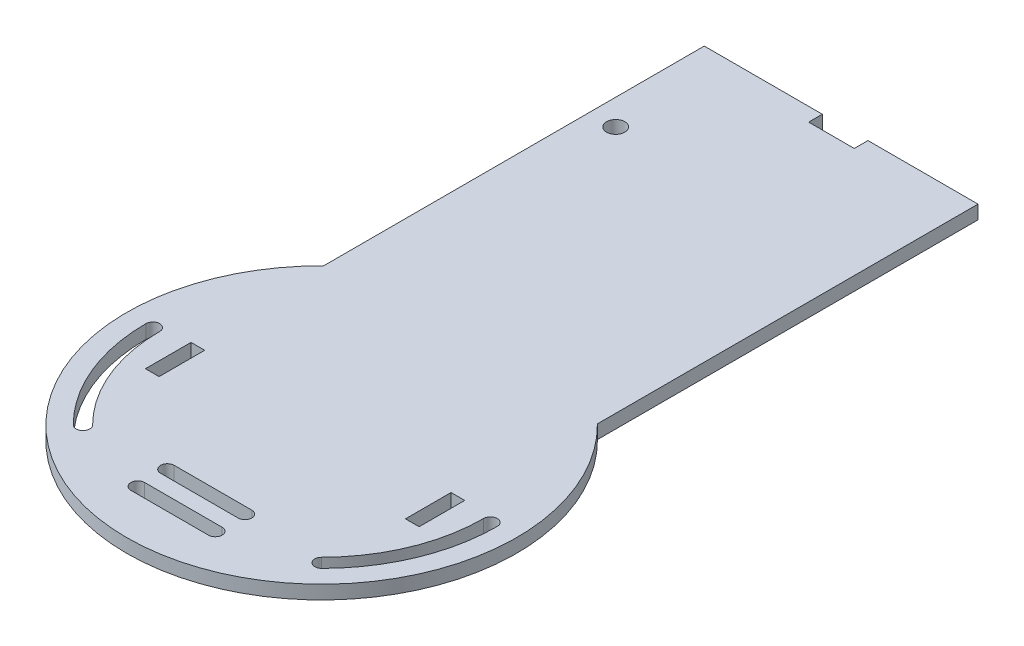
from build123d import *

# Parameters (mm, degrees)
CROQUIS1_R              = 2
CROQUIS1_W              = 3
CROQUIS1_H              = 10
SALIENTE_EXTRUIR1_DEPTH = 3


with BuildPart() as part:
    # Croquis1 → Saliente-Extruir1 (new body)
    with BuildSketch(Plane(origin=(0, 0, 0), x_dir=(1, 0, 0), z_dir=(0, 1, 0))):
        with BuildLine():
            Line((-29.945152174, -20.924198867), (-29.945152174, 62.5))
            Line((-29.945152174, 62.5), (-4.069135421, 62.5))
            Line((-4.069135421, 62.5), (-4.069135421, 59.5))
            Line((-4.069135421, 59.5), (5.930864579, 59.5))
            Line((5.930864579, 59.5), (5.930864579, 62.5))
            Line((5.930864579, 62.5), (30.054847826, 62.5))
            Line((30.054847826, 62.5), (30.054847826, -20.924198867))
            ThreePointArc((30.054847826, -20.924198867), (0.054847826, -94.111194706), (-29.945152174, -20.924198867))
        make_face()
        with Locations(Location((-24.3, 37.439181633, 0), (0, 0, 270))):
            Circle(CROQUIS1_R, mode=Mode.SUBTRACT)
        with Locations((28.554847826, -55)):
            Rectangle(CROQUIS1_W, CROQUIS1_H, mode=Mode.SUBTRACT)
        with Locations((-28.445152174, -55)):
            Rectangle(CROQUIS1_W, CROQUIS1_H, mode=Mode.SUBTRACT)
        with BuildLine():
            Line((8.554847826, -75.182623358), (-8.445152174, -75.182623358))
            ThreePointArc((-8.445152174, -75.182623358), (-9.945152174, -76.682623358), (-8.445152174, -78.182623358))
            Line((-8.445152174, -78.182623358), (8.554847826, -78.182623358))
            ThreePointArc((8.554847826, -78.182623358), (10.054847826, -76.682623358), (8.554847826, -75.182623358))
        make_face(mode=Mode.SUBTRACT)
        with BuildLine():
            Line((8.554847826, -81.682623358), (-8.445152174, -81.682623358))
            ThreePointArc((-8.445152174, -81.682623358), (-9.945152174, -83.182623358), (-8.445152174, -84.682623358))
            Line((-8.445152174, -84.682623358), (8.554847826, -84.682623358))
            ThreePointArc((8.554847826, -84.682623358), (10.054847826, -83.182623358), (8.554847826, -81.682623358))
        make_face(mode=Mode.SUBTRACT)
        with BuildLine():
            ThreePointArc((25.157138558, -76.471354215), (32.85257123, -64.954325332), (35.554847826, -51.369063483))
            ThreePointArc((35.554847826, -51.369063483), (37.054847826, -49.869063483), (38.554847826, -51.369063483))
            ThreePointArc((38.554847826, -51.369063483), (35.624209827, -66.102375629), (27.278458901, -78.592674559))
            ThreePointArc((27.278458901, -78.592674559), (25.157138558, -78.592674559), (25.157138558, -76.471354215))
        make_face(mode=Mode.SUBTRACT)
        with BuildLine():
            ThreePointArc((-35.445152174, -51.369063483), (-32.742875579, -64.954325332), (-25.047442907, -76.471354215))
            ThreePointArc((-25.047442907, -76.471354215), (-25.047442907, -78.592674559), (-27.16876325, -78.592674559))
            ThreePointArc((-27.16876325, -78.592674559), (-35.514514176, -66.102375629), (-38.445152174, -51.369063483))
            ThreePointArc((-38.445152174, -51.369063483), (-36.945152174, -49.869063483), (-35.445152174, -51.369063483))
        make_face(mode=Mode.SUBTRACT)
    extrude(amount=SALIENTE_EXTRUIR1_DEPTH)


solid = part.part
